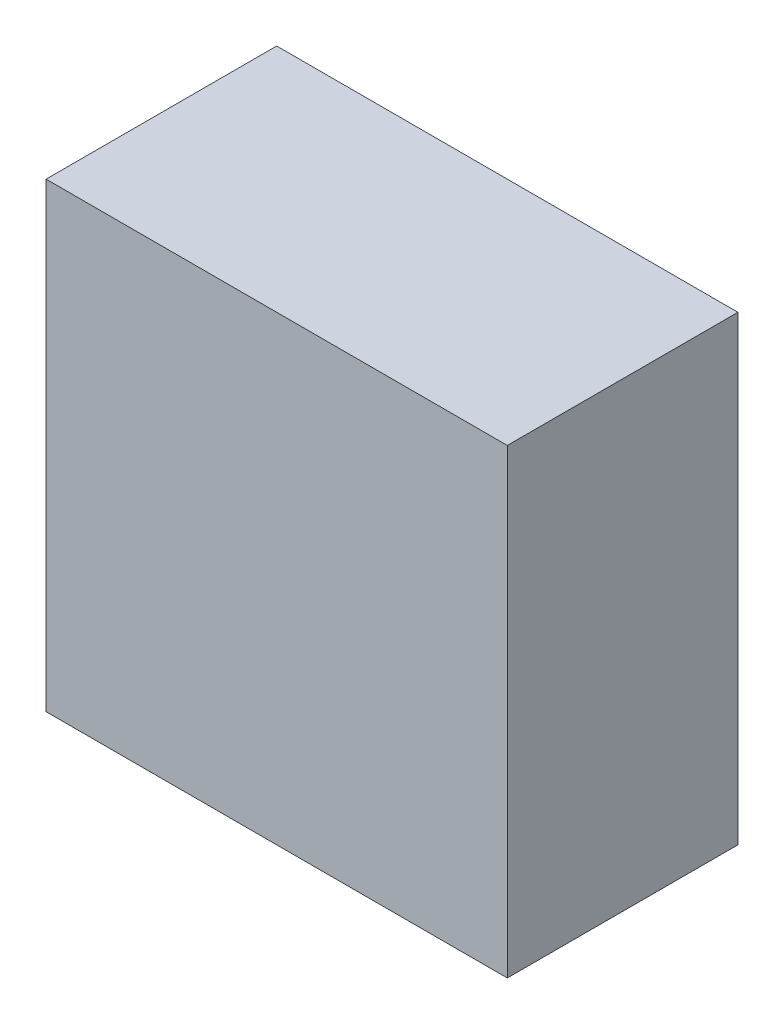
from build123d import *

# Parameters (mm, degrees)
SKETCH1_W           = 70
SKETCH1_H           = 70
BOSS_EXTRUDE1_DEPTH = 35


with BuildPart() as part:
    # Sketch1 → Boss-Extrude1 (new body)
    with BuildSketch(Plane.XY):
        with Locations((35, 35)):
            Rectangle(SKETCH1_W, SKETCH1_H)
    extrude(amount=BOSS_EXTRUDE1_DEPTH)


solid = part.part
